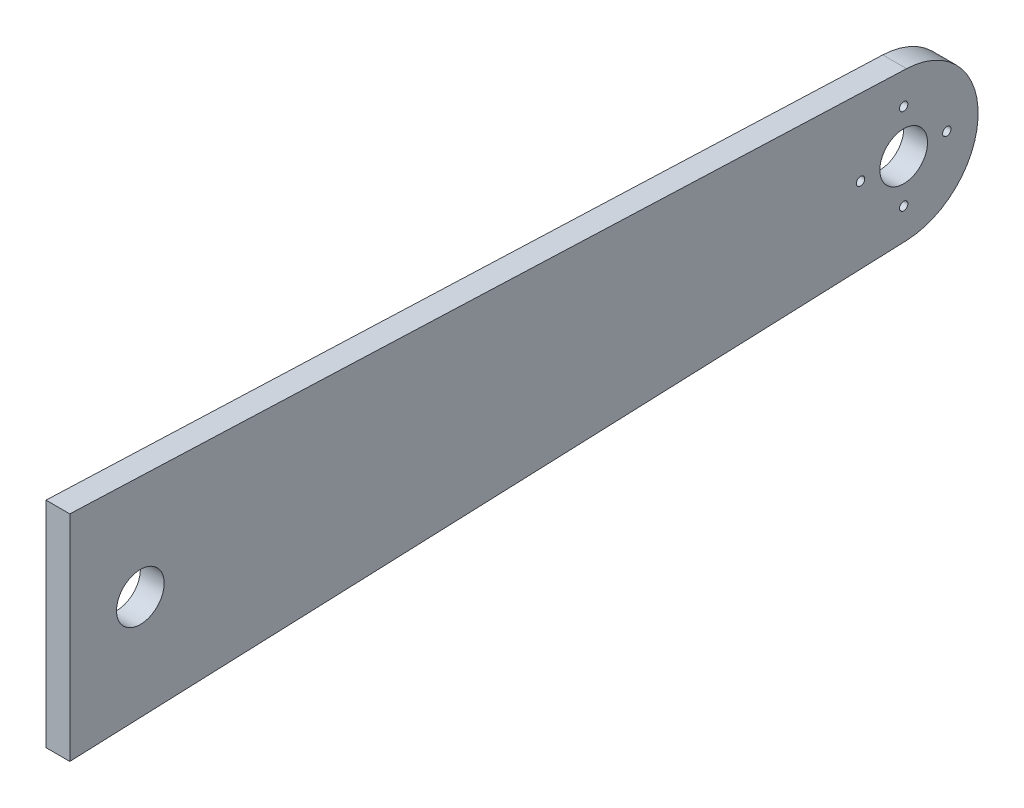
from build123d import *

# Parameters (mm, degrees)
SKETCH1_R           = 4
SKETCH1_R_2         = 0.7
BOSS_EXTRUDE1_DEPTH = 4
SKETCH2_R           = 4
CUT_EXTRUDE1_DEPTH  = 10


with BuildPart() as part:
    # Sketch1 → Boss-Extrude1 (new body)
    with BuildSketch(Plane(origin=(0, 0, 0), x_dir=(0, 0, -1), z_dir=(1, 0, 0))):
        with BuildLine():
            Line((-140, 18), (-140, -18))
            Line((-140, -18), (0.489836976, -12.490398702))
            ThreePointArc((0.489836976, -12.490398702), (12.5, 0), (0.489836976, 12.490398702))
            Line((0.489836976, 12.490398702), (-140, 18))
        make_face()
        Circle(SKETCH1_R, mode=Mode.SUBTRACT)
        with Locations((-7.24, 0)):
            Circle(SKETCH1_R_2, mode=Mode.SUBTRACT)
        with Locations((0, 7.24)):
            Circle(SKETCH1_R_2, mode=Mode.SUBTRACT)
        with Locations((7.24, 0)):
            Circle(SKETCH1_R_2, mode=Mode.SUBTRACT)
        with Locations((0, -7.24)):
            Circle(SKETCH1_R_2, mode=Mode.SUBTRACT)
    extrude(amount=BOSS_EXTRUDE1_DEPTH)

    # Sketch2 → Cut-Extrude1 (cut)
    with BuildSketch(Plane(origin=(4, 0, 0), x_dir=(0, 0, -1), z_dir=(1, 0, 0))):
        with Locations((-128.15876547, 0)):
            Circle(SKETCH2_R)
    extrude(amount=-CUT_EXTRUDE1_DEPTH, mode=Mode.SUBTRACT)


solid = part.part
